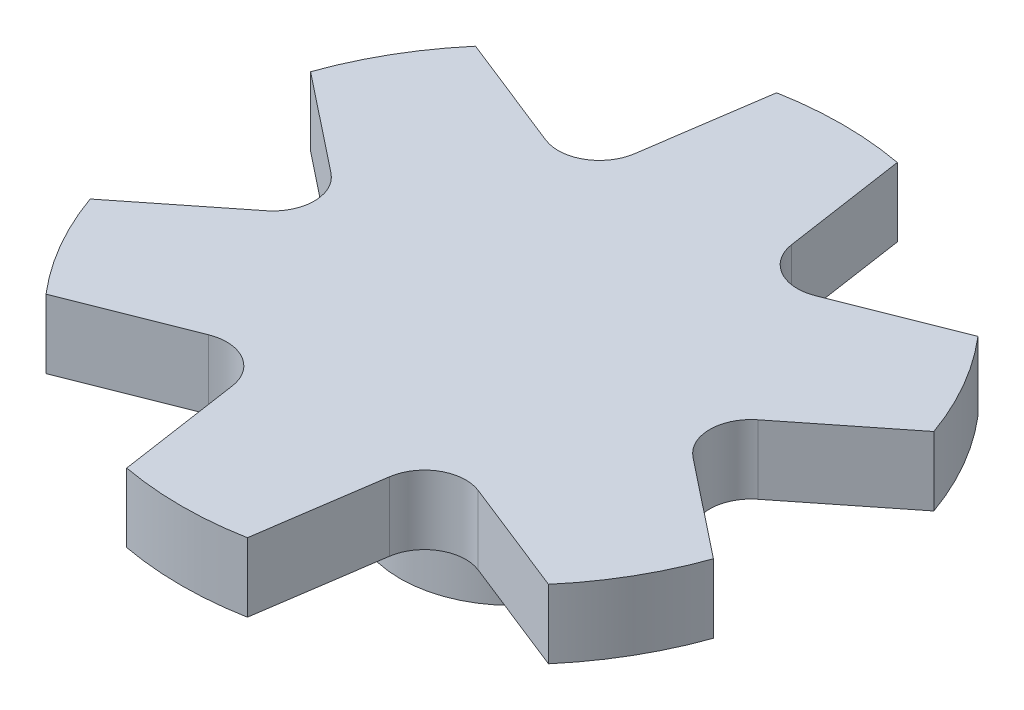
from build123d import *

# Parameters (mm, degrees)
EXTRUDE_1_DEPTH     = 2.5
SKETCH_2_R          = 4.064
SKETCH_2_R_2        = 2.54
EXTRUDE_2_DEPTH     = 3.75
SKETCH_3_R          = 18.887467654
SKETCH_3_R_2        = 12
CUT_EXTRUDE_3_DEPTH = 23.225268927


with BuildPart() as part:
    # Эскиз1 → Вытянуть1 (new body)
    with BuildSketch(Plane(origin=(0, 0, 0), x_dir=(1, 0, 0), z_dir=(0, 1, 0))):
        with BuildLine():
            Line((-1.842046714, -14.157953286), (-2.855725348, -7.29719043))
            ThreePointArc((-2.855725348, -7.29719043), (-3.589616048, -6.217397374), (-4.891689614, -6.121725913))
            Line((-4.891689614, -6.121725913), (-11.340123854, -8.674235892))
            ThreePointArc((-11.340123854, -8.674235892), (-13.856406461, -8), (-13.182170568, -5.483717394))
            Line((-13.182170568, -5.483717394), (-7.747414963, -1.175464517))
            ThreePointArc((-7.747414963, -1.175464517), (-7.179232096, 0), (-7.747414963, 1.175464517))
            Line((-7.747414963, 1.175464517), (-13.182170568, 5.483717394))
            ThreePointArc((-13.182170568, 5.483717394), (-13.856406461, 8), (-11.340123854, 8.674235892))
            Line((-11.340123854, 8.674235892), (-4.891689614, 6.121725913))
            ThreePointArc((-4.891689614, 6.121725913), (-3.589616048, 6.217397374), (-2.855725348, 7.29719043))
            Line((-2.855725348, 7.29719043), (-1.842046714, 14.157953286))
            ThreePointArc((-1.842046714, 14.157953286), (0, 16), (1.842046714, 14.157953286))
            Line((1.842046714, 14.157953286), (2.855725348, 7.29719043))
            ThreePointArc((2.855725348, 7.29719043), (3.589616048, 6.217397374), (4.891689614, 6.121725913))
            Line((4.891689614, 6.121725913), (11.340123854, 8.674235892))
            ThreePointArc((11.340123854, 8.674235892), (13.856406461, 8), (13.182170568, 5.483717394))
            Line((13.182170568, 5.483717394), (7.747414963, 1.175464517))
            ThreePointArc((7.747414963, 1.175464517), (7.179232096, 0), (7.747414963, -1.175464517))
            Line((7.747414963, -1.175464517), (13.182170568, -5.483717394))
            ThreePointArc((13.182170568, -5.483717394), (13.856406461, -8), (11.340123854, -8.674235892))
            Line((11.340123854, -8.674235892), (4.891689614, -6.121725913))
            ThreePointArc((4.891689614, -6.121725913), (3.589616048, -6.217397374), (2.855725348, -7.29719043))
            Line((2.855725348, -7.29719043), (1.842046714, -14.157953286))
            ThreePointArc((1.842046714, -14.157953286), (0, -16), (-1.842046714, -14.157953286))
        make_face()
    extrude(amount=EXTRUDE_1_DEPTH)

    # Эскиз2 → Вытянуть2 (add)
    with BuildSketch(Plane.XZ):
        with Locations(Location((0, 0, 0), (0, 0, 90))):
            Circle(SKETCH_2_R)
        with Locations(Location((0, 0, 0), (0, 0, 270))):
            Circle(SKETCH_2_R_2, mode=Mode.SUBTRACT)
    extrude(amount=EXTRUDE_2_DEPTH)

    # Эскиз3 → Вытянуть3 (cut, through all)
    with BuildSketch(Plane(origin=(0, 2.5, 0), x_dir=(-1, 0, 0), z_dir=(0, 1, 0))):
        Circle(SKETCH_3_R)
        Circle(SKETCH_3_R_2, mode=Mode.SUBTRACT)
    extrude(amount=-CUT_EXTRUDE_3_DEPTH, mode=Mode.SUBTRACT)


solid = part.part
